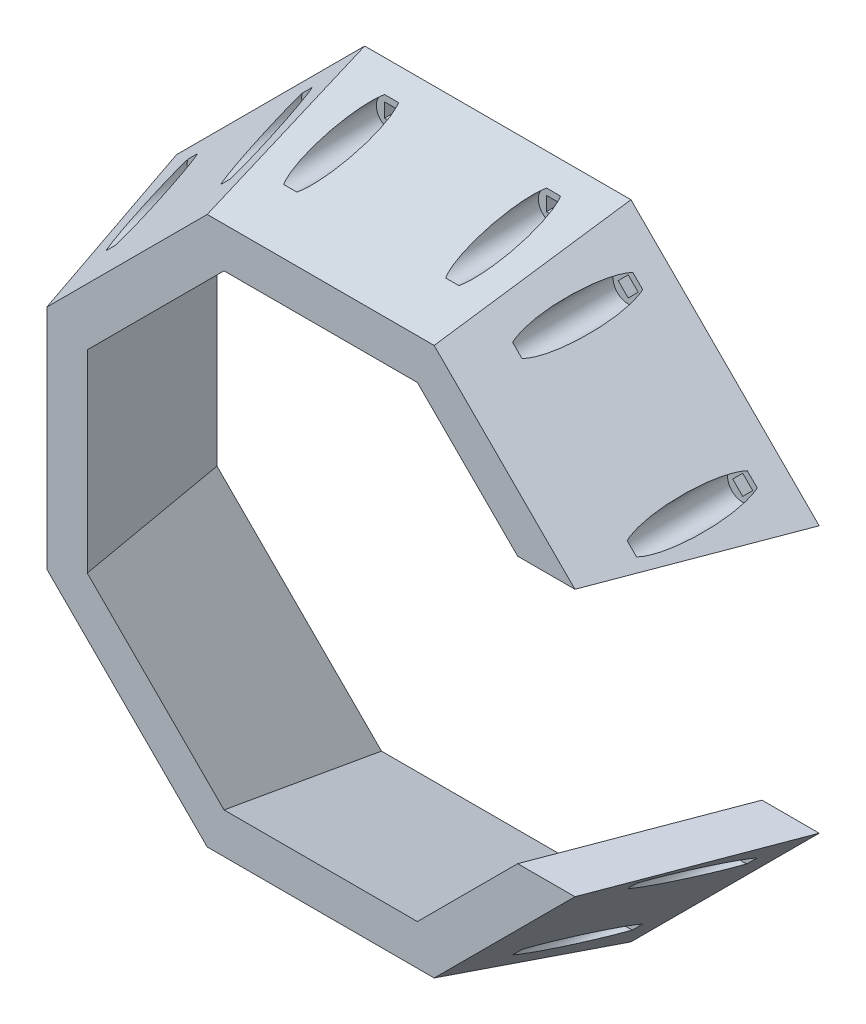
from build123d import *

# Parameters (mm, degrees)
RESSALTO_EXTRUS_O1_DEPTH = 35
RESSALTO_EXTRUS_O1_TAPER = 15
ESBO_O2_W                = 39.326456566
ESBO_O2_H                = 52.605122422
CORTE_EXTRUS_O1_DEPTH    = 50
ESBO_O5_W                = 2.8
ESBO_O5_H                = 2.8
CORTE_EXTRUS_O2_DEPTH    = 97.382052271
CORTE_EXTRUS_O3_START    = -5
ESBO_O6_R                = 3
CORTE_EXTRUS_O3_DEPTH    = 20
CORTE_EXTRUS_O4_DEPTH    = 35
CORTE_EXTRUS_O4_DRAFT    = -15


with BuildPart() as part:
    # Esboço1 → Ressalto-extrusão1 (new body)
    with BuildSketch(Plane.XY):
        Polygon((63.5, -26.302561211), (63.5, 26.302561211), (26.302561211, 63.5), (-26.302561211, 63.5), (-63.5, 26.302561211), (-63.5, -26.302561211), (-26.302561211, -63.5), (26.302561211, -63.5), align=None)
    extrude(amount=RESSALTO_EXTRUS_O1_DEPTH, taper=RESSALTO_EXTRUS_O1_TAPER)

    # Esboço2 → Corte-extrusão1 (cut)
    with BuildSketch(Plane.XY):
        with Locations((43.836771717, 0)):
            Rectangle(ESBO_O2_W, ESBO_O2_H)
    extrude(amount=CORTE_EXTRUS_O1_DEPTH, mode=Mode.SUBTRACT)

    # Esboço5 → Corte-extrusão2 (cut, through all)
    with BuildSketch(Plane(origin=(0, 0, 0), x_dir=(-1, 0, 0), z_dir=(0, 0, -1))):
        with Locations((-16, 59.5)):
            Rectangle(ESBO_O5_W, ESBO_O5_H)
        Polygon((30.759144982, 55.366460967), (32.739043969, 53.38656198), (30.759144982, 51.406662992), (28.779245994, 53.38656198), align=None)
        with Locations((16, 59.5)):
            Rectangle(ESBO_O5_W, ESBO_O5_H)
        Polygon((53.38656198, 32.739043969), (55.366460967, 30.759144982), (53.38656198, 28.779245994), (51.406662992, 30.759144982), align=None)
        with Locations((59.5, 16)):
            Rectangle(ESBO_O5_W, ESBO_O5_H)
        with Locations((59.5, -16)):
            Rectangle(ESBO_O5_W, ESBO_O5_H)
        Polygon((55.366460967, -30.759144982), (53.38656198, -32.739043969), (51.406662992, -30.759144982), (53.38656198, -28.779245994), align=None)
        Polygon((32.739043969, -53.38656198), (30.759144982, -55.366460967), (28.779245994, -53.38656198), (30.759144982, -51.406662992), align=None)
        with Locations((16, -59.5)):
            Rectangle(ESBO_O5_W, ESBO_O5_H)
        with Locations((-16, -59.5)):
            Rectangle(ESBO_O5_W, ESBO_O5_H)
        Polygon((-30.759144982, -55.366460967), (-32.739043969, -53.38656198), (-30.759144982, -51.406662992), (-28.779245994, -53.38656198), align=None)
        Polygon((-53.38656198, -32.739043969), (-55.366460967, -30.759144982), (-53.38656198, -28.779245994), (-51.406662992, -30.759144982), align=None)
        with Locations((-59.5, -16)):
            Rectangle(ESBO_O5_W, ESBO_O5_H)
        with Locations((-59.5, 16)):
            Rectangle(ESBO_O5_W, ESBO_O5_H)
        Polygon((-55.366460967, 30.759144982), (-53.38656198, 32.739043969), (-51.406662992, 30.759144982), (-53.38656198, 28.779245994), align=None)
        Polygon((-32.739043969, 53.38656198), (-30.759144982, 55.366460967), (-28.779245994, 53.38656198), (-30.759144982, 51.406662992), align=None)
    extrude(amount=-CORTE_EXTRUS_O2_DEPTH, mode=Mode.SUBTRACT)

    # Esboço6 → Corte-extrusão3 (cut)
    with BuildSketch(Plane(origin=(0, 0, 0), x_dir=(-1, 0, 0), z_dir=(0, 0, -1)).offset(CORTE_EXTRUS_O3_START)):
        with Locations((-16, 59.5)):
            Circle(ESBO_O6_R)
        with Locations((16, 59.5)):
            Circle(ESBO_O6_R)
        with Locations((30.759144982, 53.38656198)):
            Circle(ESBO_O6_R)
        with Locations((53.38656198, 30.759144982)):
            Circle(ESBO_O6_R)
        with Locations((59.5, 16)):
            Circle(ESBO_O6_R)
        with Locations((59.5, -16)):
            Circle(ESBO_O6_R)
        with Locations((53.38656198, -30.759144982)):
            Circle(ESBO_O6_R)
        with Locations((30.759144982, -53.38656198)):
            Circle(ESBO_O6_R)
        with Locations((16, -59.5)):
            Circle(ESBO_O6_R)
        with Locations((-16, -59.5)):
            Circle(ESBO_O6_R)
        with Locations((-30.759144982, -53.38656198)):
            Circle(ESBO_O6_R)
        with Locations((-53.38656198, -30.759144982)):
            Circle(ESBO_O6_R)
        with Locations((-59.5, -16)):
            Circle(ESBO_O6_R)
        with Locations((-59.5, 16)):
            Circle(ESBO_O6_R)
        with Locations((-53.38656198, 30.759144982)):
            Circle(ESBO_O6_R)
        with Locations((-30.759144982, 53.38656198)):
            Circle(ESBO_O6_R)
    extrude(amount=-CORTE_EXTRUS_O3_DEPTH, mode=Mode.SUBTRACT)


with BuildPart() as corte_extrus_o4_tool:
    # Esboço9 → Corte-extrusão4 (with draft: the straight prism first)
    with BuildSketch(Plane(origin=(0, 0, 0), x_dir=(-1, 0, 0), z_dir=(0, 0, -1))):
        Polygon((22.988852712, 55.5), (-22.988852712, 55.5), (-55.5, 22.988852712), (-55.5, -22.988852712), (-22.988852712, -55.5), (22.988852712, -55.5), (55.5, -22.988852712), (55.5, 22.988852712), align=None)
    extrude(amount=-CORTE_EXTRUS_O4_DEPTH)
    # Corte-extrusão4: the draft: its side faces are tilted about the plane it starts from
    corte_extrus_o4_sides = [corte_extrus_o4_tool.faces().sort_by_distance(p)[0] for p in [
        (0, 55.5, 17.5),
        (39.244426356, 39.244426356, 17.5),
        (55.5, 0, 17.5),
        (39.244426356, -39.244426356, 17.5),
        (0, -55.5, 17.5),
        (-39.244426356, -39.244426356, 17.5),
        (-55.5, 0, 17.5),
        (-39.244426356, 39.244426356, 17.5),
    ]]
    draft(corte_extrus_o4_sides, Plane(origin=(0, 0, 0), x_dir=(-1, 0, 0), z_dir=(0, 0, -1)), CORTE_EXTRUS_O4_DRAFT)


with BuildPart() as part_1:
    add(part.part)

    # Corte-extrusão4: cut by corte_extrus_o4_tool
    add(corte_extrus_o4_tool.part, mode=Mode.SUBTRACT)


solid = part_1.part
